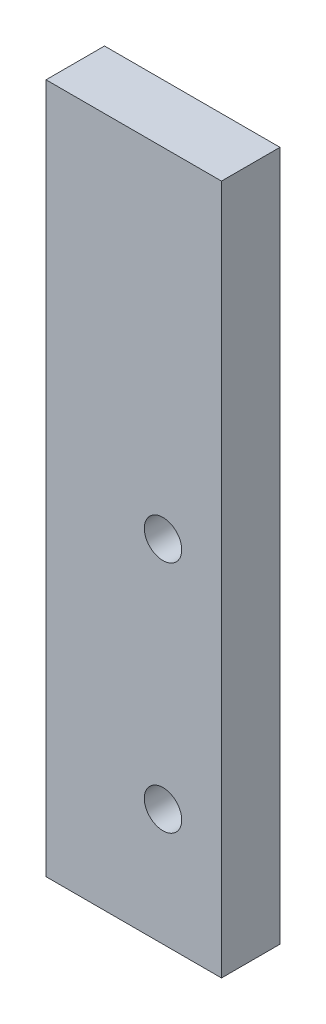
from build123d import *

# Parameters (mm, degrees)
SKETCH_1_W          = 15
SKETCH_1_H          = 59
EXTRUDE_1_DEPTH     = 5
SKETCH_2_R          = 1.6
CUT_EXTRUDE_1_DEPTH = 5


with BuildPart() as part:
    # 草图1 → 凸台-拉伸1 (new body)
    with BuildSketch(Plane.XY):
        with Locations((7.5, 29.5)):
            Rectangle(SKETCH_1_W, SKETCH_1_H)
    extrude(amount=EXTRUDE_1_DEPTH)

    # 草图2 → 切除-拉伸1 (cut)
    with BuildSketch(Plane.XY.offset(5)):
        with Locations((10, 10)):
            Circle(SKETCH_2_R)
        with Locations((10, 30)):
            Circle(SKETCH_2_R)
    extrude(amount=-CUT_EXTRUDE_1_DEPTH, mode=Mode.SUBTRACT)


solid = part.part
